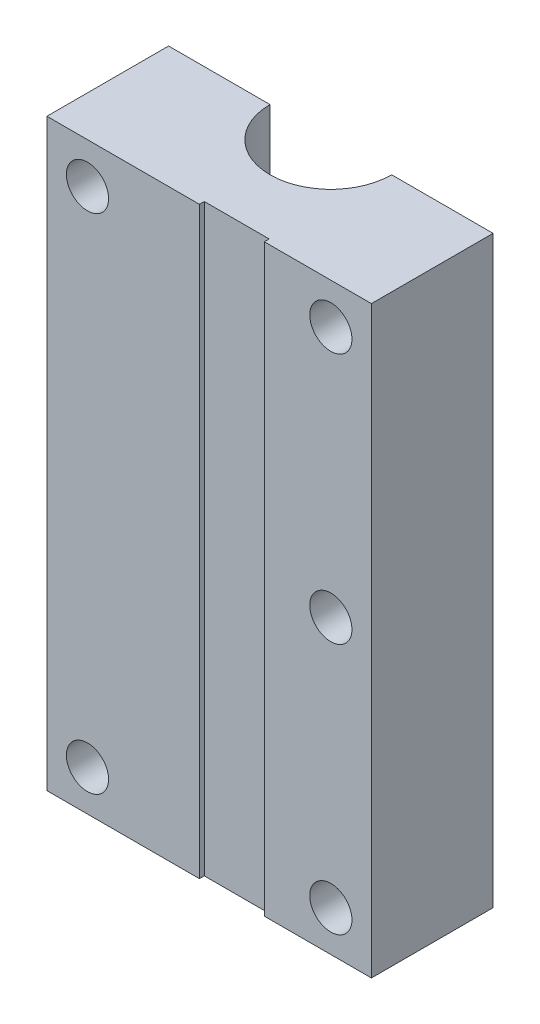
from build123d import *

# Parameters (mm, degrees)
BOSS_EXTRUDE1_DEPTH = 36
CUT_EXTRUDE1_DEPTH  = 16.5
SKETCH3_W           = 8
SKETCH3_H           = 77.131502371
CUT_EXTRUDE2_DEPTH  = 0.6
SKETCH4_R           = 2.6
CUT_EXTRUDE3_DEPTH  = 56.865910894


with BuildPart() as part:
    # Sketch1 → Boss-Extrude1 (new, symmetric)
    with BuildSketch(Plane(origin=(0, 0, 0), x_dir=(1, 0, 0), z_dir=(0, 1, 0))):
        with BuildLine():
            Line((27.5, 15), (40, 15))
            Line((40, 15), (40, 0))
            Line((40, 0), (0, 0))
            Line((0, 0), (0, 15))
            Line((0, 15), (12.5, 15))
            ThreePointArc((12.5, 15), (20, 7.5), (27.5, 15))
        make_face()
    extrude(amount=BOSS_EXTRUDE1_DEPTH, both=True)

    # Sketch2 → Cut-Extrude1 (cut, symmetric)
    with BuildSketch(Plane(origin=(0, 0, 0), x_dir=(1, 0, 0), z_dir=(0, 1, 0))):
        with BuildLine():
            Line((8.458861594, 15), (31.458861594, 15))
            ThreePointArc((31.458861594, 15), (19.958861594, 3.5), (8.458861594, 15))
        make_face()
    extrude(amount=CUT_EXTRUDE1_DEPTH, both=True, mode=Mode.SUBTRACT)

    # Sketch3 → Cut-Extrude2 (cut)
    with BuildSketch(Plane.XY):
        with Locations((22.8, -0.239836761)):
            Rectangle(SKETCH3_W, SKETCH3_H)
    extrude(amount=-CUT_EXTRUDE2_DEPTH, mode=Mode.SUBTRACT)

    # Sketch4 → Cut-Extrude3 (cut, through all)
    with BuildSketch(Plane.XY):
        with Locations((5, 31)):
            Circle(SKETCH4_R)
        with Locations((35, 31)):
            Circle(SKETCH4_R)
        with Locations((35, -31)):
            Circle(SKETCH4_R)
        with Locations((5, -31)):
            Circle(SKETCH4_R)
        with Locations((35, 0)):
            Circle(SKETCH4_R)
    extrude(amount=-CUT_EXTRUDE3_DEPTH, mode=Mode.SUBTRACT)


solid = part.part
